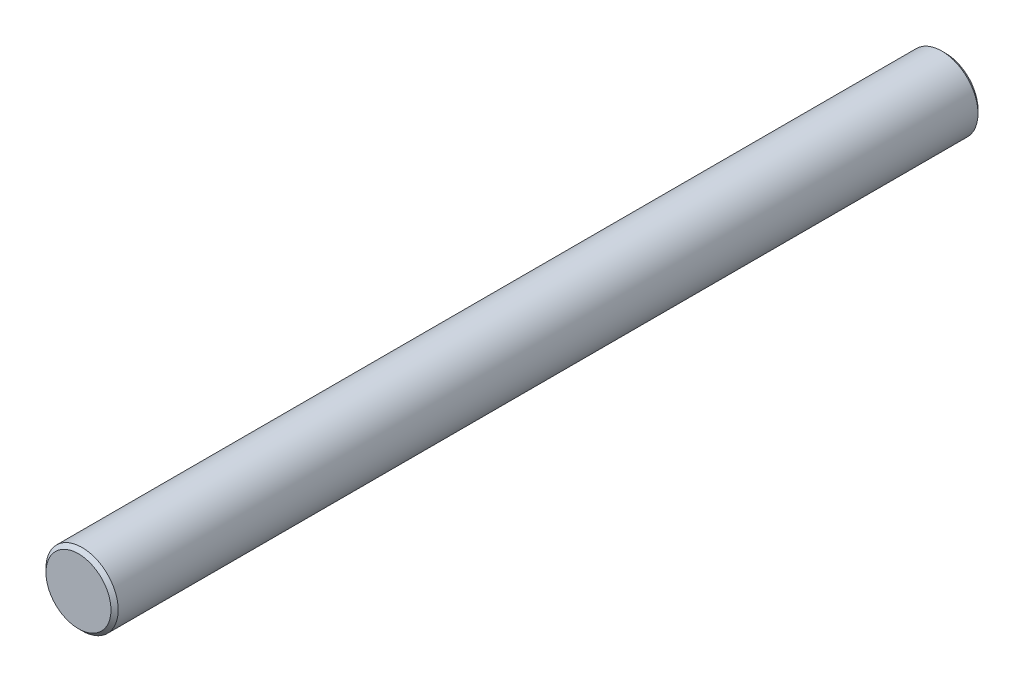
from build123d import *

# Parameters (mm, degrees)
SKETCH1_R           = 5
BOSS_EXTRUDE1_DEPTH = 60
CHAMFER1_SIZE       = 0.5


with BuildPart() as part:
    # Sketch1 → Boss-Extrude1 (new, symmetric)
    with BuildSketch(Plane.XY):
        Circle(SKETCH1_R)
    extrude(amount=BOSS_EXTRUDE1_DEPTH, both=True)

    # Chamfer1
    chamfer1_edges = [part.edges().sort_by_distance(p)[0] for p in [
        (-5, 0, -60),
        (-5, 0, 60),
    ]]
    chamfer(chamfer1_edges, length=CHAMFER1_SIZE)


solid = part.part
